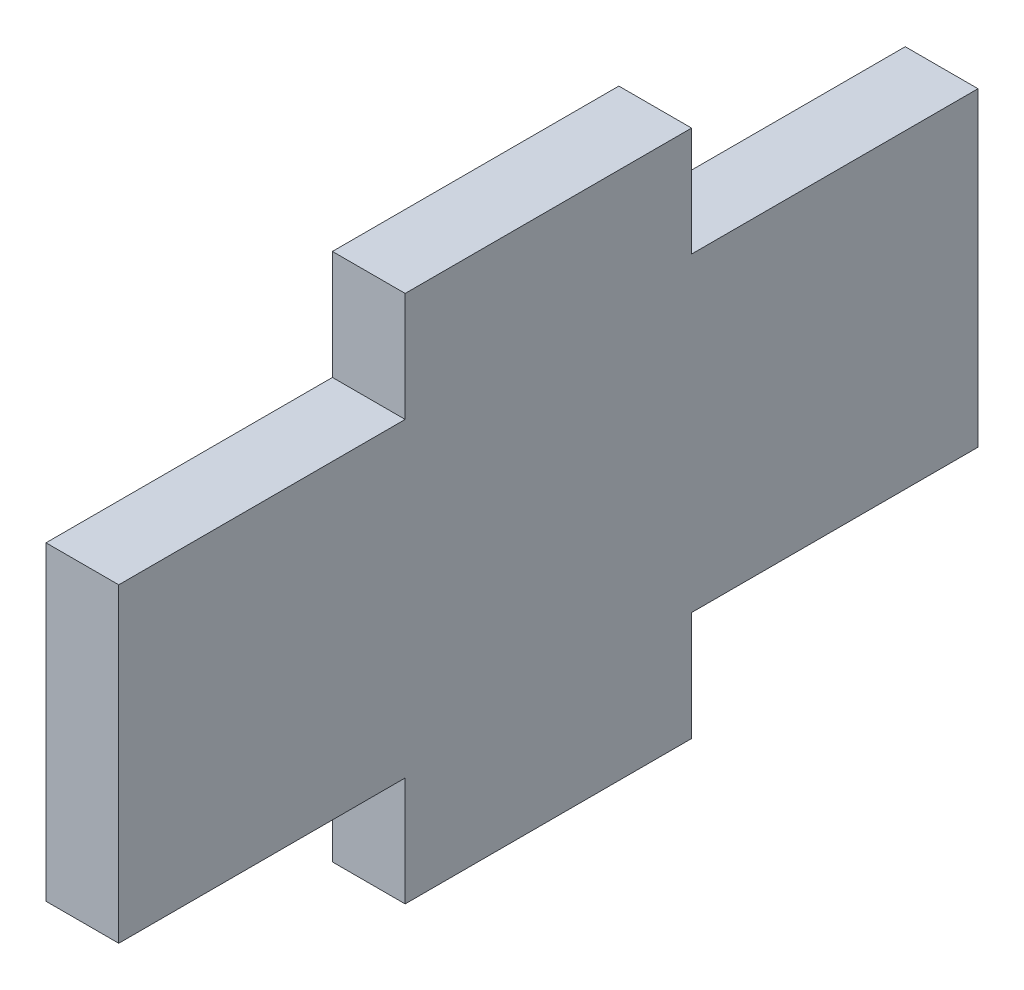
from build123d import *

# Parameters (mm, degrees)
BOSS_EXTRUDE1_DEPTH = 3.175


with BuildPart() as part:
    # Sketch1 → Boss-Extrude1 (new, symmetric)
    with BuildSketch(Plane(origin=(0, 0, 0), x_dir=(0, 0, -1), z_dir=(1, 0, 0))):
        Polygon((12.5, 23.075), (12.5, 13.55), (37.5, 13.55), (37.5, 0), (-37.5, 0), (-37.5, 13.55), (-12.5, 13.55), (-12.5, 23.075), align=None)
    boss_extrude1 = extrude(amount=BOSS_EXTRUDE1_DEPTH, both=True)

    # Mirror1: Boss-Extrude1 across plane
    add(boss_extrude1.mirror(Plane.ZX))


solid = part.part
